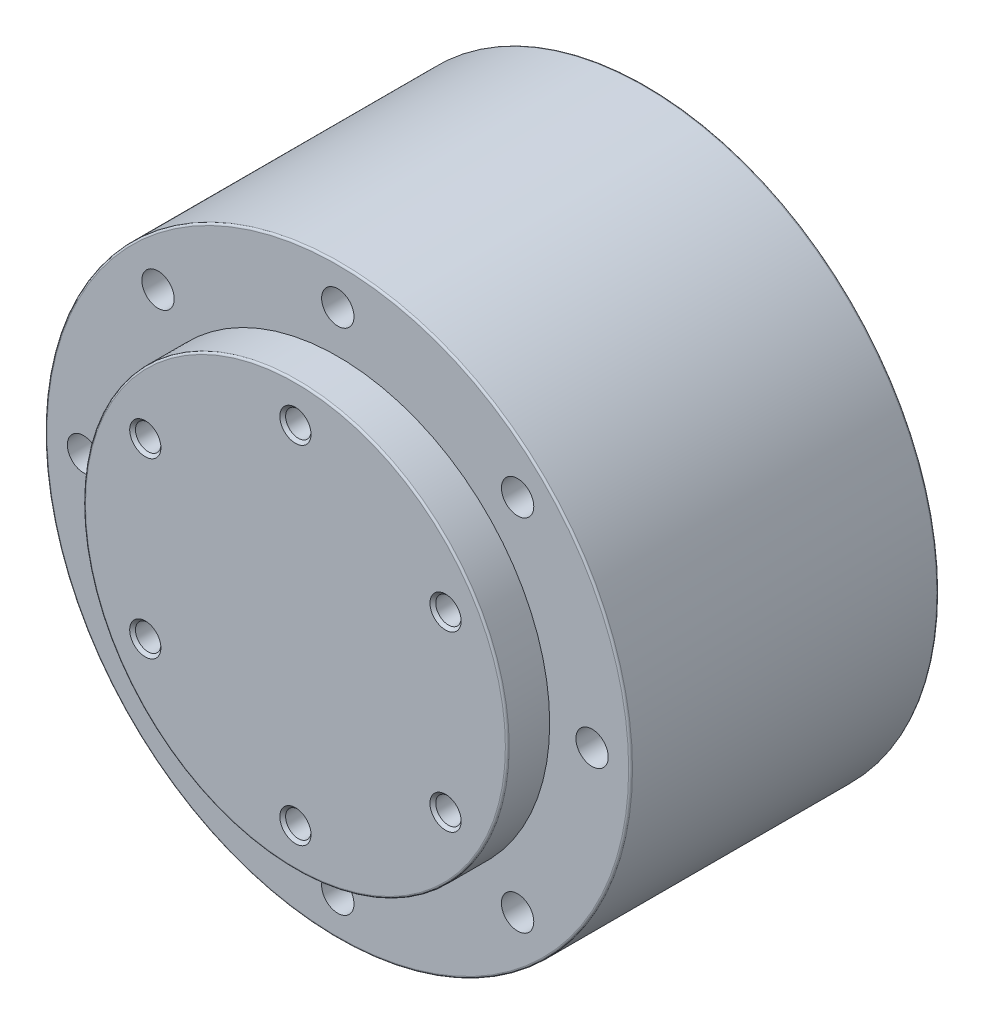
from build123d import *

# Parameters (mm, degrees)
SKETCH_1_R                   = 38
EXTRUDE_1_DEPTH              = 20
SKETCH_2_R                   = 27.5
EXTRUDE_2_DEPTH              = 5.5
HOLE_WIZARD_M5_1_D           = 4.2
HOLE_WIZARD_M5_1_CSINK_D     = 5.05
HOLE_WIZARD_M5_1_CSINK_ANGLE = 90
HOLE_WIZARD_M4_1_D           = 3.3
HOLE_WIZARD_M4_1_DEPTH       = 10.1
HOLE_WIZARD_M4_1_CSINK_D     = 4.05
HOLE_WIZARD_M4_1_CSINK_ANGLE = 90
HOLE_WIZARD_M4_1_TIP         = 0.991420021
FILLET_1_R                   = 0.25


with BuildPart() as part:
    # 草图1 → 凸台-拉伸1 (new, symmetric)
    with BuildSketch(Plane.XY):
        Circle(SKETCH_1_R)
    extrude(amount=EXTRUDE_1_DEPTH, both=True)

    # 草图2 → 凸台-拉伸2 (add)
    with BuildSketch(Plane.XY.offset(20)):
        Circle(SKETCH_2_R)
    extrude(amount=EXTRUDE_2_DEPTH)

    # M5 螺纹孔1 (through all)
    with Locations(Plane(origin=(0, 33, -20), x_dir=(-1, 0, 0), z_dir=(0, 0, -1))):
        with Locations((0, 0), (23.334523779, -9.665476221), (33, -33), (23.334523779, -56.334523779), (0, -66), (-23.334523779, -56.334523779), (-33, -33), (-23.334523779, -9.665476221)):
            CounterSinkHole(HOLE_WIZARD_M5_1_D / 2, HOLE_WIZARD_M5_1_CSINK_D / 2, counter_sink_angle=HOLE_WIZARD_M5_1_CSINK_ANGLE)

    # M4 螺纹孔1
    with Locations(Plane(origin=(0, 22.5, 25.5), x_dir=(1, 0, 0), z_dir=(0, 0, 1))):
        with Locations((0, 0), (19.485571585, -11.25), (19.485571585, -33.75), (0, -45), (-19.485571585, -33.75), (-19.485571585, -11.25)):
            CounterSinkHole(HOLE_WIZARD_M4_1_D / 2, HOLE_WIZARD_M4_1_CSINK_D / 2, depth=HOLE_WIZARD_M4_1_DEPTH, counter_sink_angle=HOLE_WIZARD_M4_1_CSINK_ANGLE)
            with Locations((0, 0, -(HOLE_WIZARD_M4_1_DEPTH + HOLE_WIZARD_M4_1_TIP / 2))):  # 118° drill point
                Cone(0, HOLE_WIZARD_M4_1_D / 2, HOLE_WIZARD_M4_1_TIP, mode=Mode.SUBTRACT)

    # 圆角1
    fillet_1_edges = [part.edges().sort_by_distance(p)[0] for p in [
        (-38, 0, -20),
        (-38, 0, 20),
        (-27.5, 0, 25.5),
    ]]
    fillet(fillet_1_edges, radius=FILLET_1_R)


solid = part.part
